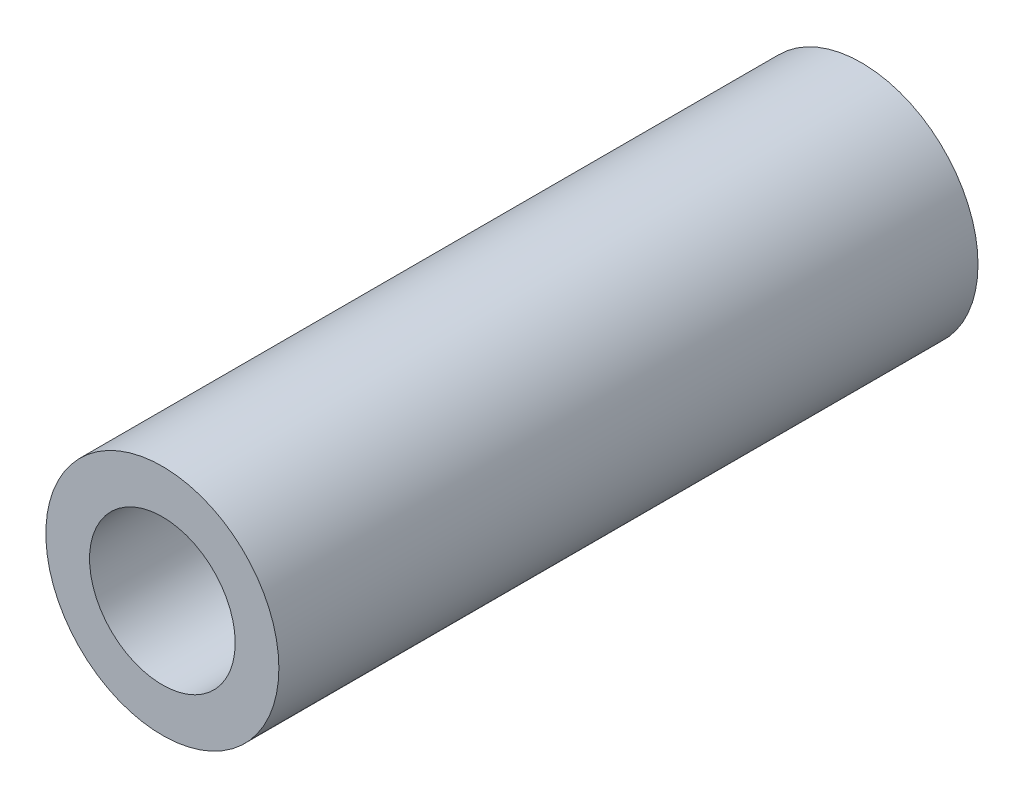
from build123d import *

# Parameters (mm, degrees)
ESQUISSE1_R        = 2
BOSS_EXTRU_1_DEPTH = 12
TROU_TARAUD_M31_D  = 2.5


with BuildPart() as part:
    # Esquisse1 → Boss.-Extru.1 (new body)
    with BuildSketch(Plane.XY):
        Circle(ESQUISSE1_R)
    extrude(amount=BOSS_EXTRU_1_DEPTH)

    # Trou taraudé M31 (through all)
    with Locations(Plane.XY.offset(12)):
        with Locations((0, 0)):
            Hole(TROU_TARAUD_M31_D / 2)


solid = part.part
